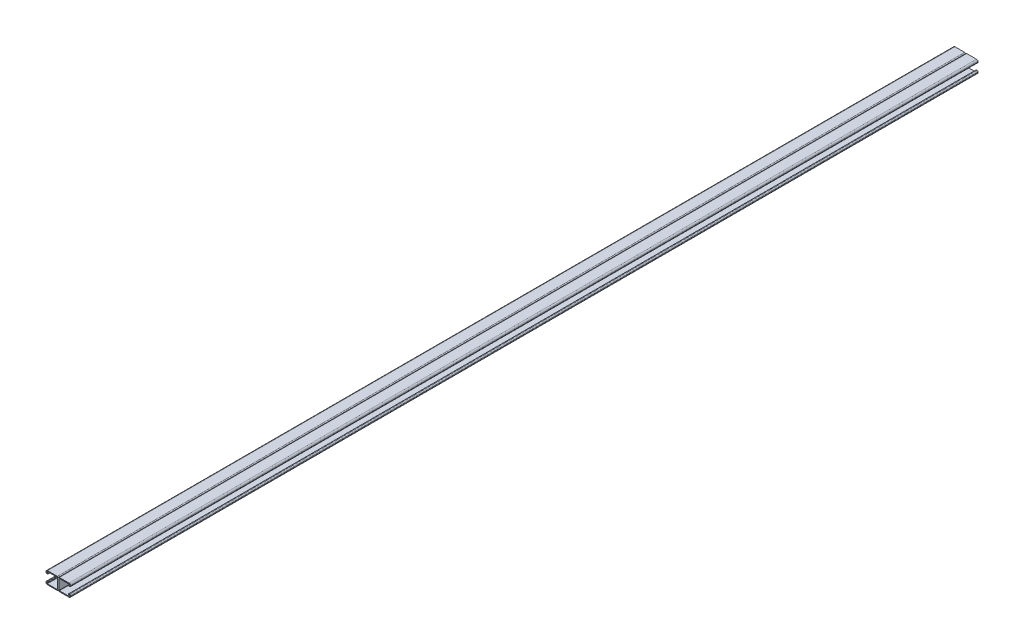
from build123d import *

# Parameters (mm, degrees)
BOSS_EXTRUDE1_DEPTH = 3048


with BuildPart() as part:
    # Sketch1 → Boss-Extrude1 (new body)
    with BuildSketch(Plane.XY):
        with BuildLine():
            Line((-36.22675, 20.6375), (-3.46075, 20.6375))
            ThreePointArc((-3.46075, 20.6375), (-1.013630207, 19.623869793), (0, 17.17675))
            Line((0, 17.17675), (0, -17.17675))
            ThreePointArc((0, -17.17675), (-1.013630207, -19.623869793), (-3.46075, -20.6375))
            Line((-3.46075, -20.6375), (-36.22675, -20.6375))
            ThreePointArc((-36.22675, -20.6375), (-39.796401808, -19.158901808), (-41.275, -15.58925))
            Line((-41.275, -15.58925), (-41.275, -14.57325))
            ThreePointArc((-41.275, -14.57325), (-40.261369793, -12.126130207), (-37.81425, -11.1125))
            Line((-37.81425, -11.1125), (-35.5346, -11.1125))
            ThreePointArc((-35.5346, -11.1125), (-34.1376, -12.5095), (-35.5346, -13.9065))
            Line((-35.5346, -13.9065), (-37.81425, -13.9065))
            ThreePointArc((-37.81425, -13.9065), (-38.285713446, -14.101786554), (-38.481, -14.57325))
            Line((-38.481, -14.57325), (-38.481, -15.58925))
            ThreePointArc((-38.481, -15.58925), (-37.820745461, -17.183245461), (-36.22675, -17.8435))
            Line((-36.22675, -17.8435), (-3.46075, -17.8435))
            ThreePointArc((-3.46075, -17.8435), (-2.989286554, -17.648213446), (-2.794, -17.17675))
            Line((-2.794, -17.17675), (-2.794, 17.17675))
            ThreePointArc((-2.794, 17.17675), (-2.989286554, 17.648213446), (-3.46075, 17.8435))
            Line((-3.46075, 17.8435), (-36.22675, 17.8435))
            ThreePointArc((-36.22675, 17.8435), (-37.820745461, 17.183245461), (-38.481, 15.58925))
            Line((-38.481, 15.58925), (-38.481, 14.57325))
            ThreePointArc((-38.481, 14.57325), (-38.285713446, 14.101786554), (-37.81425, 13.9065))
            Line((-37.81425, 13.9065), (-35.5346, 13.9065))
            ThreePointArc((-35.5346, 13.9065), (-34.1376, 12.5095), (-35.5346, 11.1125))
            Line((-35.5346, 11.1125), (-37.81425, 11.1125))
            ThreePointArc((-37.81425, 11.1125), (-40.261369793, 12.126130207), (-41.275, 14.57325))
            Line((-41.275, 14.57325), (-41.275, 15.58925))
            ThreePointArc((-41.275, 15.58925), (-39.796401808, 19.158901808), (-36.22675, 20.6375))
        make_face()
    extrude(amount=-BOSS_EXTRUDE1_DEPTH)


with BuildPart() as body_2:
    # Mirror1: mirrored copy
    add(part.part.mirror(Plane(origin=(0, 17.17675, -3048), x_dir=(0, 0, 1), z_dir=(1, 0, 0))))

    # Combine1: union part
    add(part.part)


solid = body_2.part
